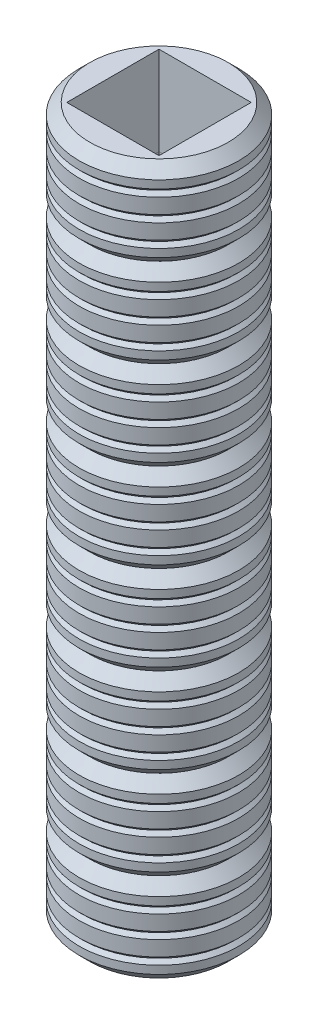
from build123d import *

# Parameters (mm, degrees)
SKETCH1_R           = 5.715
SKETCH1_W           = 6.604
SKETCH1_H           = 6.604
BOSS_EXTRUDE1_DEPTH = 0.79375
CHAMFER1_SIZE       = 0.254
LPATTERN1_COUNT     = 2
LPATTERN1_PITCH     = 1.5875
LPATTERN1_2_COUNT   = 3
LPATTERN1_2_PITCH   = 1.5875
LPATTERN2_COUNT     = 8
LPATTERN2_PITCH     = 6.35


with BuildPart() as part:
    # Sketch1 → Boss-Extrude1 (new, symmetric)
    with BuildSketch(Plane(origin=(0, 0, 0), x_dir=(1, 0, 0), z_dir=(0, 1, 0))):
        with Locations(Location((0, 0, 0), (0, 0, 270))):
            Circle(SKETCH1_R)
        Rectangle(SKETCH1_W, SKETCH1_H, mode=Mode.SUBTRACT)
    extrude(amount=BOSS_EXTRUDE1_DEPTH, both=True)

    # Chamfer1
    chamfer1_edges = [part.edges().sort_by_distance(p)[0] for p in [
        (0, -0.79375, -5.715),
        (0, 0.79375, -5.715),
    ]]
    chamfer(chamfer1_edges, length=CHAMFER1_SIZE)


with BuildPart() as lpattern1_1:
    # LPattern1: pattern copy
    add(part.part.moved(Location(Vector(0, 1, 0) * (1 * LPATTERN1_PITCH))))


with BuildPart() as lpattern1_2_1:
    # LPattern1 2: pattern copy
    add(part.part.moved(Location(Vector(0, -1, 0) * (1 * LPATTERN1_2_PITCH))))


with BuildPart() as lpattern1_2_2:
    # LPattern1 2: pattern copy
    add(part.part.moved(Location(Vector(0, -1, 0) * (2 * LPATTERN1_2_PITCH))))


with BuildPart() as cut_revolve3_tool:
    # Sketch3 → Cut-Revolve3 (revolve)
    with BuildSketch(Plane(origin=(0, 0, 0), x_dir=(0, 0, -1), z_dir=(1, 0, 0))):
        Polygon((-5.847993112, -3.073756888), (-5.847993112, -4.863743112), (-4.953, -3.96875), align=None)
        Polygon((-5.847993112, 1.486256888), (-5.847993112, 3.276243112), (-4.953, 2.38125), align=None)
    revolve(axis=Axis((0, 0, 0), (0, 1, 0)))


with BuildPart() as lpattern1_1_1:
    add(lpattern1_1.part)

    # Cut-Revolve3: cut by cut_revolve3_tool
    add(cut_revolve3_tool.part, mode=Mode.SUBTRACT)


with BuildPart() as lpattern1_2_2_1:
    add(lpattern1_2_2.part)

    # Cut-Revolve3: cut by cut_revolve3_tool
    add(cut_revolve3_tool.part, mode=Mode.SUBTRACT)


with BuildPart() as part_1:
    add(part.part)

    # Combine1: union LPattern1 2_2, LPattern1 2_1, LPattern1_1
    add(lpattern1_2_2_1.part)
    add(lpattern1_2_1.part)
    add(lpattern1_1_1.part)


with BuildPart() as lpattern2_1:
    # LPattern2: pattern copy
    add(part_1.part.moved(Location(Vector(0, -1, 0) * (1 * LPATTERN2_PITCH))))


with BuildPart() as lpattern2_2:
    # LPattern2: pattern copy
    add(part_1.part.moved(Location(Vector(0, -1, 0) * (2 * LPATTERN2_PITCH))))


with BuildPart() as lpattern2_3:
    # LPattern2: pattern copy
    add(part_1.part.moved(Location(Vector(0, -1, 0) * (3 * LPATTERN2_PITCH))))


with BuildPart() as lpattern2_4:
    # LPattern2: pattern copy
    add(part_1.part.moved(Location(Vector(0, -1, 0) * (4 * LPATTERN2_PITCH))))


with BuildPart() as lpattern2_5:
    # LPattern2: pattern copy
    add(part_1.part.moved(Location(Vector(0, -1, 0) * (5 * LPATTERN2_PITCH))))


with BuildPart() as lpattern2_6:
    # LPattern2: pattern copy
    add(part_1.part.moved(Location(Vector(0, -1, 0) * (6 * LPATTERN2_PITCH))))


with BuildPart() as lpattern2_7:
    # LPattern2: pattern copy
    add(part_1.part.moved(Location(Vector(0, -1, 0) * (7 * LPATTERN2_PITCH))))


solid = Compound([part_1.part, lpattern2_1.part, lpattern2_2.part, lpattern2_3.part, lpattern2_4.part, lpattern2_5.part, lpattern2_6.part, lpattern2_7.part])
